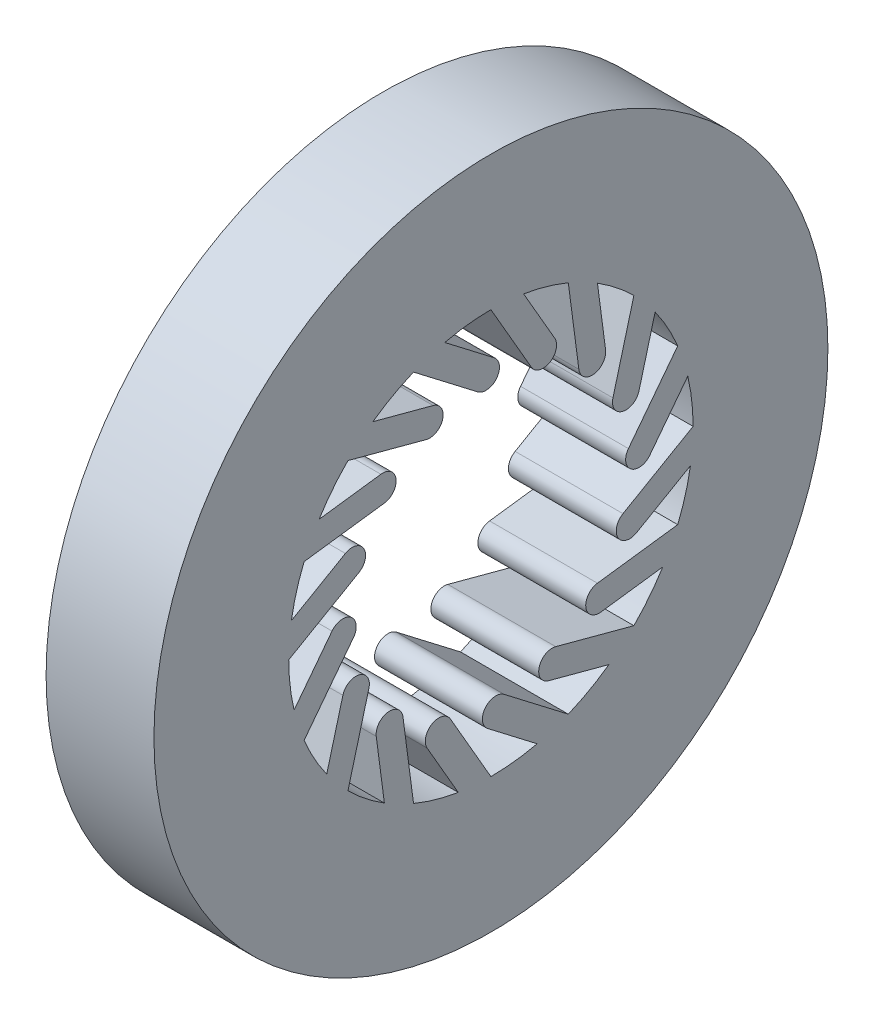
from build123d import *

# Parameters (mm, degrees)
SKETCH1_R         = 25
MAGNET_RING_DEPTH = 8


with BuildPart() as part:
    # Sketch1 → Magnet ring (new body)
    with BuildSketch(Plane(origin=(0, 0, 0), x_dir=(0, 0, -1), z_dir=(1, 0, 0))):
        Circle(SKETCH1_R)
        with BuildLine():
            Line((0, 15), (3.004130517, 9.796693311))
            ThreePointArc((3.004130517, 9.796693311), (4.370155921, 9.430667907), (4.736181325, 10.796693311))
            Line((4.736181325, 10.796693311), (2.423147953, 14.802984631))
            ThreePointArc((2.423147953, 14.802984631), (4.10894517, 14.426245859), (5.740251485, 13.858192988))
            Line((5.740251485, 13.858192988), (6.52448692, 7.901333459))
            ThreePointArc((6.52448692, 7.901333459), (7.646457974, 7.04041479), (8.507376643, 8.162385843))
            Line((8.507376643, 8.162385843), (7.903553766, 12.748875945))
            ThreePointArc((7.903553766, 12.748875945), (9.316855624, 11.755688039), (10.606601718, 10.606601718))
            Line((10.606601718, 10.606601718), (9.051549334, 4.803067213))
            ThreePointArc((9.051549334, 4.803067213), (9.758656115, 3.578322342), (10.983400987, 4.285429123))
            Line((10.983400987, 4.285429123), (12.180715164, 8.753866465))
            ThreePointArc((12.180715164, 8.753866465), (13.106359267, 7.295433281), (13.858192988, 5.740251485))
            Line((13.858192988, 5.740251485), (10.200595414, 0.973577524))
            ThreePointArc((10.200595414, 0.973577524), (10.385187325, -0.428537245), (11.787302095, -0.243945334))
            Line((11.787302095, -0.243945334), (14.603473097, 3.42616017))
            ThreePointArc((14.603473097, 3.42616017), (14.900538521, 1.724514939), (15, 0))
            Line((15, 0), (9.796693311, -3.004130517))
            ThreePointArc((9.796693311, -3.004130517), (9.430667907, -4.370155921), (10.796693311, -4.736181325))
            Line((10.796693311, -4.736181325), (14.802984631, -2.423147953))
            ThreePointArc((14.802984631, -2.423147953), (14.426245859, -4.10894517), (13.858192988, -5.740251485))
            Line((13.858192988, -5.740251485), (7.901333459, -6.52448692))
            ThreePointArc((7.901333459, -6.52448692), (7.04041479, -7.646457974), (8.162385843, -8.507376643))
            Line((8.162385843, -8.507376643), (12.748875945, -7.903553766))
            ThreePointArc((12.748875945, -7.903553766), (11.755688039, -9.316855624), (10.606601718, -10.606601718))
            Line((10.606601718, -10.606601718), (4.803067213, -9.051549334))
            ThreePointArc((4.803067213, -9.051549334), (3.578322342, -9.758656115), (4.285429123, -10.983400987))
            Line((4.285429123, -10.983400987), (8.753866465, -12.180715164))
            ThreePointArc((8.753866465, -12.180715164), (7.295433281, -13.106359267), (5.740251485, -13.858192988))
            Line((5.740251485, -13.858192988), (0.973577524, -10.200595414))
            ThreePointArc((0.973577524, -10.200595414), (-0.428537245, -10.385187325), (-0.243945334, -11.787302095))
            Line((-0.243945334, -11.787302095), (3.42616017, -14.603473097))
            ThreePointArc((3.42616017, -14.603473097), (1.724514939, -14.900538521), (0, -15))
            Line((0, -15), (-3.004130517, -9.796693311))
            ThreePointArc((-3.004130517, -9.796693311), (-4.370155921, -9.430667907), (-4.736181325, -10.796693311))
            Line((-4.736181325, -10.796693311), (-2.423147953, -14.802984631))
            ThreePointArc((-2.423147953, -14.802984631), (-4.10894517, -14.426245859), (-5.740251485, -13.858192988))
            Line((-5.740251485, -13.858192988), (-6.52448692, -7.901333459))
            ThreePointArc((-6.52448692, -7.901333459), (-7.646457974, -7.04041479), (-8.507376643, -8.162385843))
            Line((-8.507376643, -8.162385843), (-7.903553766, -12.748875945))
            ThreePointArc((-7.903553766, -12.748875945), (-9.316855624, -11.755688039), (-10.606601718, -10.606601718))
            Line((-10.606601718, -10.606601718), (-9.051549334, -4.803067213))
            ThreePointArc((-9.051549334, -4.803067213), (-9.758656115, -3.578322342), (-10.983400987, -4.285429123))
            Line((-10.983400987, -4.285429123), (-12.180715164, -8.753866465))
            ThreePointArc((-12.180715164, -8.753866465), (-13.106359267, -7.295433281), (-13.858192988, -5.740251485))
            Line((-13.858192988, -5.740251485), (-10.200595414, -0.973577524))
            ThreePointArc((-10.200595414, -0.973577524), (-10.385187325, 0.428537245), (-11.787302095, 0.243945334))
            Line((-11.787302095, 0.243945334), (-14.603473097, -3.42616017))
            ThreePointArc((-14.603473097, -3.42616017), (-14.900538521, -1.724514939), (-15, 0))
            Line((-15, 0), (-9.796693311, 3.004130517))
            ThreePointArc((-9.796693311, 3.004130517), (-9.430667907, 4.370155921), (-10.796693311, 4.736181325))
            Line((-10.796693311, 4.736181325), (-14.802984631, 2.423147953))
            ThreePointArc((-14.802984631, 2.423147953), (-14.426245859, 4.10894517), (-13.858192988, 5.740251485))
            Line((-13.858192988, 5.740251485), (-7.901333459, 6.52448692))
            ThreePointArc((-7.901333459, 6.52448692), (-7.04041479, 7.646457974), (-8.162385843, 8.507376643))
            Line((-8.162385843, 8.507376643), (-12.748875945, 7.903553766))
            ThreePointArc((-12.748875945, 7.903553766), (-11.755688039, 9.316855624), (-10.606601718, 10.606601718))
            Line((-10.606601718, 10.606601718), (-4.803067213, 9.051549334))
            ThreePointArc((-4.803067213, 9.051549334), (-3.578322342, 9.758656115), (-4.285429123, 10.983400987))
            Line((-4.285429123, 10.983400987), (-8.753866465, 12.180715164))
            ThreePointArc((-8.753866465, 12.180715164), (-7.295433281, 13.106359267), (-5.740251485, 13.858192988))
            Line((-5.740251485, 13.858192988), (-0.973577524, 10.200595414))
            ThreePointArc((-0.973577524, 10.200595414), (0.428537245, 10.385187325), (0.243945334, 11.787302095))
            Line((0.243945334, 11.787302095), (-3.42616017, 14.603473097))
            ThreePointArc((-3.42616017, 14.603473097), (-1.724514939, 14.900538521), (0, 15))
        make_face(mode=Mode.SUBTRACT)
    extrude(amount=MAGNET_RING_DEPTH)


solid = part.part
